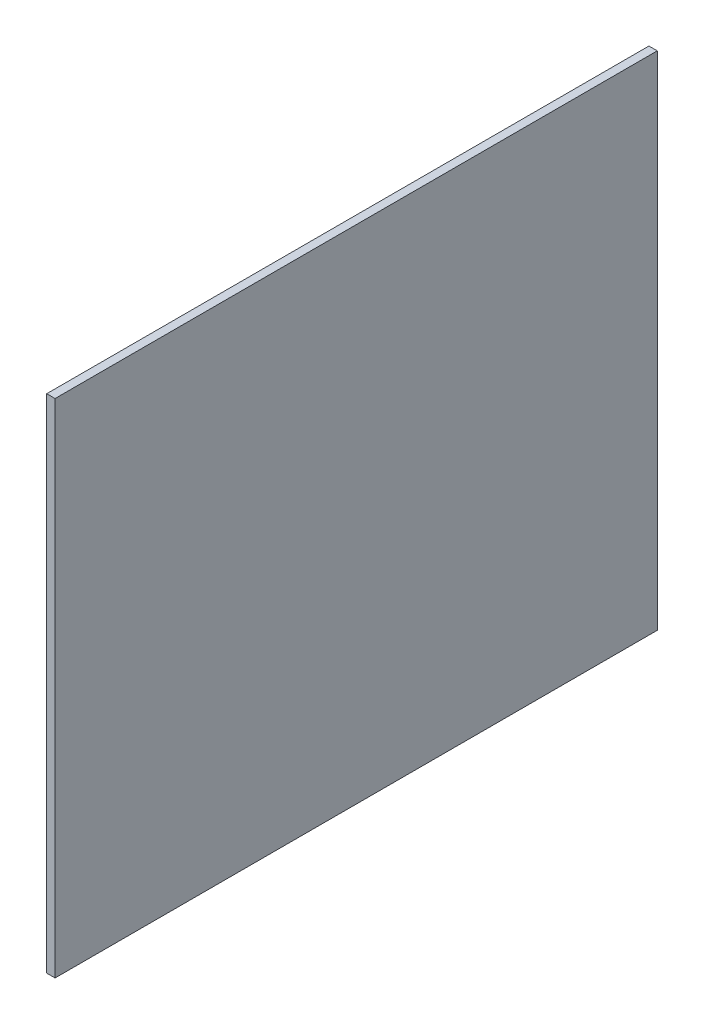
from build123d import *

# Parameters (mm, degrees)
ESBO_O1_W                = 360
ESBO_O1_H                = 300
RESSALTO_EXTRUS_O1_DEPTH = 5


with BuildPart() as part:
    # Esboço1 → Ressalto-extrusão1 (new body)
    with BuildSketch(Plane(origin=(0, 0, 0), x_dir=(0, 0, -1), z_dir=(1, 0, 0))):
        Rectangle(ESBO_O1_W, ESBO_O1_H)
    extrude(amount=RESSALTO_EXTRUS_O1_DEPTH)


solid = part.part
